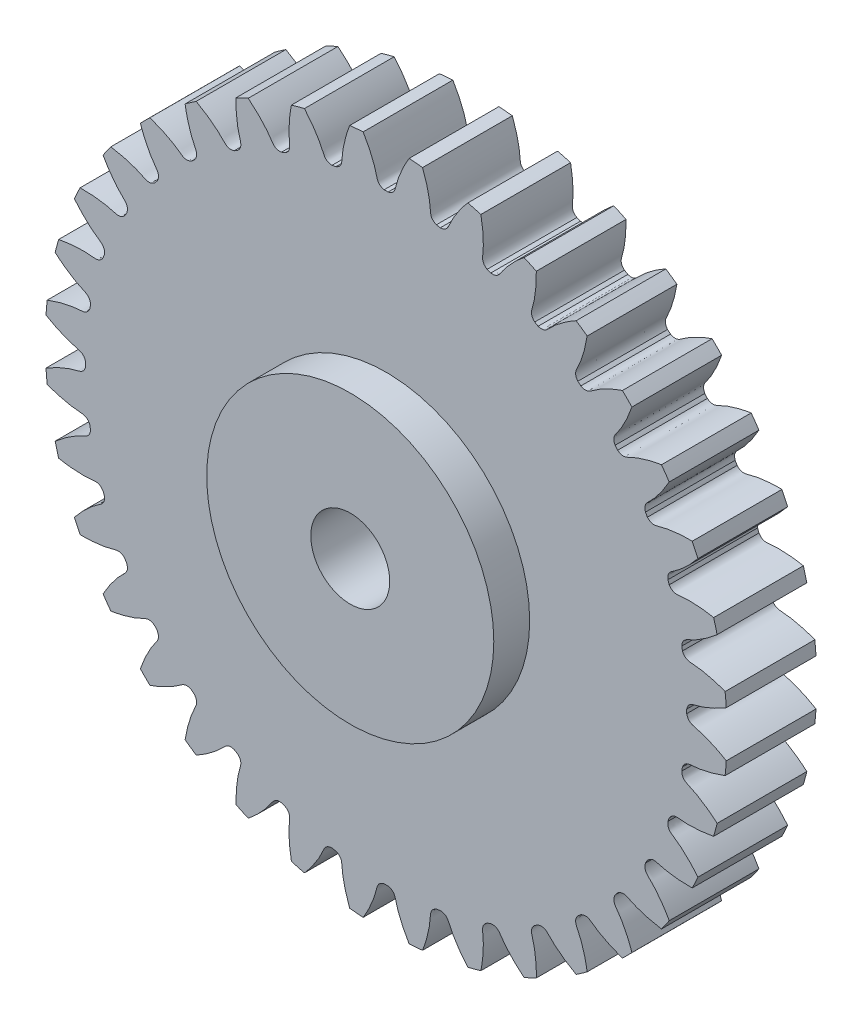
from build123d import *

# Parameters (mm, degrees)
SKETCH_1_R               = 9.5
EXTRUDE_1_DEPTH          = 2.5
CUT_EXTRUDE_1_DEPTH      = 14.665650369
PATTERN_CIRCULAR_1_COUNT = 36
SKETCH_4_R               = 4
EXTRUDE_2_DEPTH          = 3.5
CUT_EXTRUDE_2_REACH      = 15.854
SKETCH_5_R               = 1.1


with BuildPart() as part:
    # 草图1 → 凸台-拉伸1 (new body)
    with BuildSketch(Plane.XY):
        Circle(SKETCH_1_R)
    extrude(amount=EXTRUDE_1_DEPTH)

    # 草图2 → 切除-拉伸1 (cut, through all)
    with BuildSketch(Plane.XY):
        with BuildLine():
            ThreePointArc((0.054934474, 8.374819831), (0, 8.375), (-0.054934474, 8.374819831))
            add(Edge.make_bspline(
                [(-0.054934474, 8.374819831), (-0.234978953, 8.415201319), (-0.250497423, 8.549314662), (-0.288218357, 8.691373568), (-0.299748628, 8.731851177), (-0.31309989, 8.775314366), (-0.328367396, 8.821718829), (-0.34568221, 8.870999935), (-0.365162519, 8.923094297), (-0.386928046, 8.977933385), (-0.411095645, 9.035445483), (-0.437780475, 9.09555517), (-0.467095531, 9.15818354), (-0.499151661, 9.223248205), (-0.534057436, 9.290663368), (-0.571919068, 9.360339873), (-0.612840323, 9.432185269), (-0.656922424, 9.506103874), (-0.704263969, 9.581996838), (-0.754960844, 9.659762209), (-0.809106137, 9.739295006), (-0.866790057, 9.820487287), (-0.928099853, 9.903228226), (-0.993119734, 9.987404187), (-1.061930793, 10.072898798), (-1.134610932, 10.15959304), (-1.211234787, 10.247365317), (-1.291873657, 10.33609155), (-1.376595441, 10.425645255), (-1.46546454, 10.515897632), (-1.591181957, 10.63856609), (-1.689482035, 10.72881939), (-1.757006718, 10.78843362)],
                knots=[0, 0, 0, 0, 0.120371484, 0.133302531, 0.147363917, 0.16255564, 0.178877702, 0.196330101, 0.214912839, 0.234625915, 0.25546933, 0.277443082, 0.300547173, 0.324781601, 0.350146368, 0.376641473, 0.404266917, 0.433022698, 0.462908818, 0.493925275, 0.526072071, 0.559349205, 0.593756678, 0.629294488, 0.665962637, 0.703761124, 0.742689949, 0.782749112, 0.823938613, 0.866258453, 0.90970863, 1, 1, 1, 1], degree=3))
            ThreePointArc((-1.757006718, 10.78843362), (0, 10.930570551), (1.757006718, 10.78843362))
            add(Edge.make_bspline(
                [(0.054934474, 8.374819831), (0.234978953, 8.415201319), (0.250497423, 8.549314662), (0.288218357, 8.691373568), (0.299748628, 8.731851177), (0.31309989, 8.775314366), (0.328367396, 8.821718829), (0.34568221, 8.870999935), (0.365162519, 8.923094297), (0.386928046, 8.977933385), (0.411095645, 9.035445483), (0.437780475, 9.09555517), (0.467095531, 9.15818354), (0.499151661, 9.223248205), (0.534057436, 9.290663368), (0.571919068, 9.360339873), (0.612840323, 9.432185269), (0.656922424, 9.506103874), (0.704263969, 9.581996838), (0.754960844, 9.659762209), (0.809106137, 9.739295006), (0.866790057, 9.820487287), (0.928099853, 9.903228226), (0.993119734, 9.987404187), (1.061930793, 10.072898798), (1.134610932, 10.15959304), (1.211234787, 10.247365317), (1.291873657, 10.33609155), (1.376595441, 10.425645255), (1.46546454, 10.515897632), (1.591181957, 10.63856609), (1.689482035, 10.72881939), (1.757006718, 10.78843362)],
                knots=[0, 0, 0, 0, 0.120371484, 0.133302531, 0.147363917, 0.16255564, 0.178877702, 0.196330101, 0.214912839, 0.234625915, 0.25546933, 0.277443082, 0.300547173, 0.324781601, 0.350146368, 0.376641473, 0.404266917, 0.433022698, 0.462908818, 0.493925275, 0.526072071, 0.559349205, 0.593756678, 0.629294488, 0.665962637, 0.703761124, 0.742689949, 0.782749112, 0.823938613, 0.866258453, 0.90970863, 1, 1, 1, 1], degree=3))
        make_face()
    cut_extrude_1 = extrude(amount=CUT_EXTRUDE_1_DEPTH, mode=Mode.SUBTRACT)

    # 阵列(圆周)1: 切除-拉伸1 ×36 about axis
    pattern_circular_1_axis = Axis((0, 0, 2.5), (0, 0, -1))
    for i in range(1, PATTERN_CIRCULAR_1_COUNT):
        add(cut_extrude_1.rotate(pattern_circular_1_axis, i * 360 / PATTERN_CIRCULAR_1_COUNT), mode=Mode.SUBTRACT)

    # 草图4 → 凸台-拉伸2 (add)
    with BuildSketch(Plane(origin=(0, 0, 0), x_dir=(-1, 0, 0), z_dir=(0, 0, -1))):
        with Locations(Location((0, 0, 0), (0, 0, 180))):
            Circle(SKETCH_4_R)
    extrude(amount=-EXTRUDE_2_DEPTH)

    # 草图5 → 切除-拉伸2 (cut, up to next)
    with BuildSketch(Plane.XY.offset(3.5), mode=Mode.PRIVATE) as cut_extrude_2_sk1:
        Circle(SKETCH_5_R)
    cut_extrude_2_tool1 = extrude(cut_extrude_2_sk1.sketch, amount=-CUT_EXTRUDE_2_REACH, mode=Mode.PRIVATE) & part.part
    add(cut_extrude_2_tool1.solids().sort_by_distance((0, 0, 3.5))[0], mode=Mode.SUBTRACT)


solid = part.part
